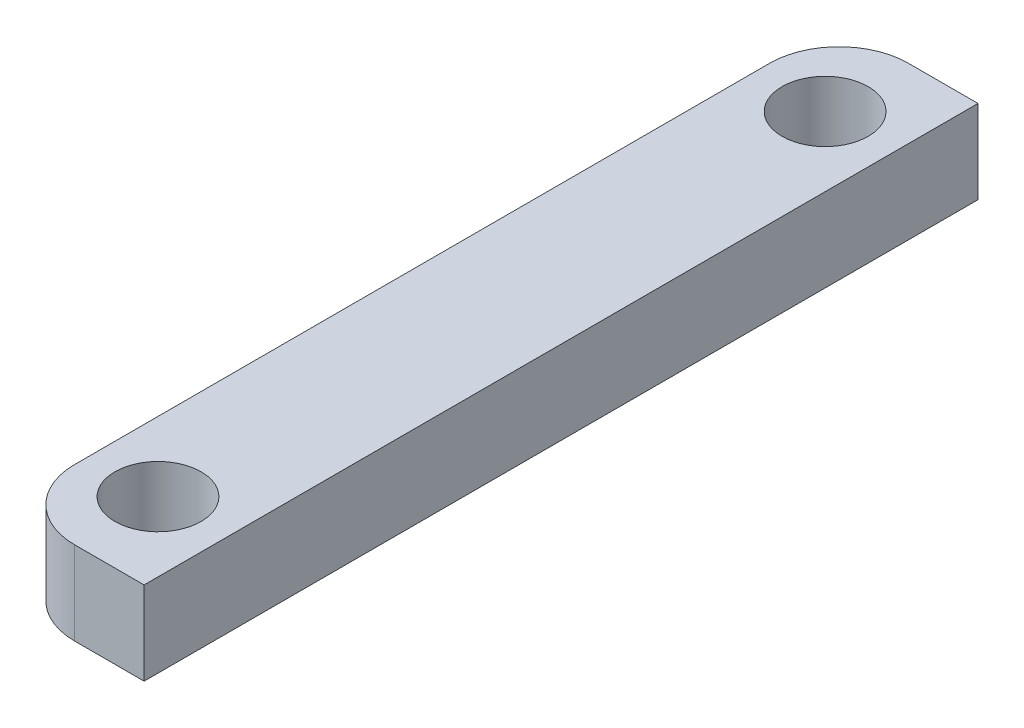
from build123d import *

# Parameters (mm, degrees)
SKETCH1_W           = 5
SKETCH1_H           = 30
SKETCH1_R           = 1.55
BOSS_EXTRUDE1_DEPTH = 3
FILLET1_R           = 2.5


with BuildPart() as part:
    # Sketch1 → Boss-Extrude1 (new body)
    with BuildSketch(Plane(origin=(0, 0, 0), x_dir=(1, 0, 0), z_dir=(0, 1, 0))):
        Rectangle(SKETCH1_W, SKETCH1_H)
        with Locations(Location((0, 12, 0), (0, 0, 270))):
            Circle(SKETCH1_R, mode=Mode.SUBTRACT)
        with Locations(Location((0, -12, 0), (0, 0, 270))):
            Circle(SKETCH1_R, mode=Mode.SUBTRACT)
    extrude(amount=BOSS_EXTRUDE1_DEPTH)

    # Fillet1
    fillet1_edges = [part.edges().sort_by_distance(p)[0] for p in [
        (-2.5, 1.5, 15),
        (-2.5, 1.5, -15),
    ]]
    fillet(fillet1_edges, radius=FILLET1_R)


solid = part.part
